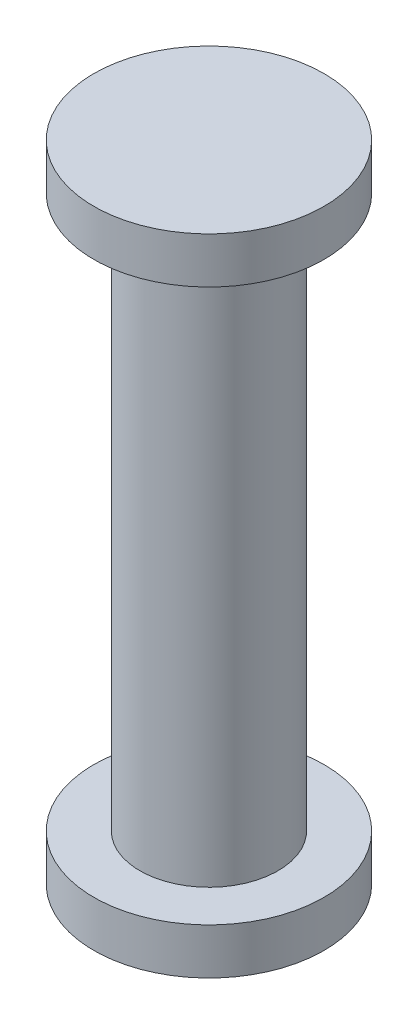
from build123d import *


with BuildPart() as part:
    # Sketch2 → Revolve1 (revolve)
    with BuildSketch(Plane.XY, mode=Mode.PRIVATE) as revolve1_sk:
        Polygon((6.283324022, -4.38970455), (6.283324022, 9.61029545), (3.783324022, 9.61029545), (3.783324022, 8.61029545), (4.783324022, 8.61029545), (4.783324022, -3.38970455), (3.783324022, -3.38970455), (3.783324022, -4.38970455), align=None)
    revolve(revolve1_sk.sketch.rotate(Axis((6.283324022, -4.38970455, 0), (0, 1, 0)), 270), axis=Axis((6.283324022, -4.38970455, 0), (0, 1, 0)))


solid = part.part
